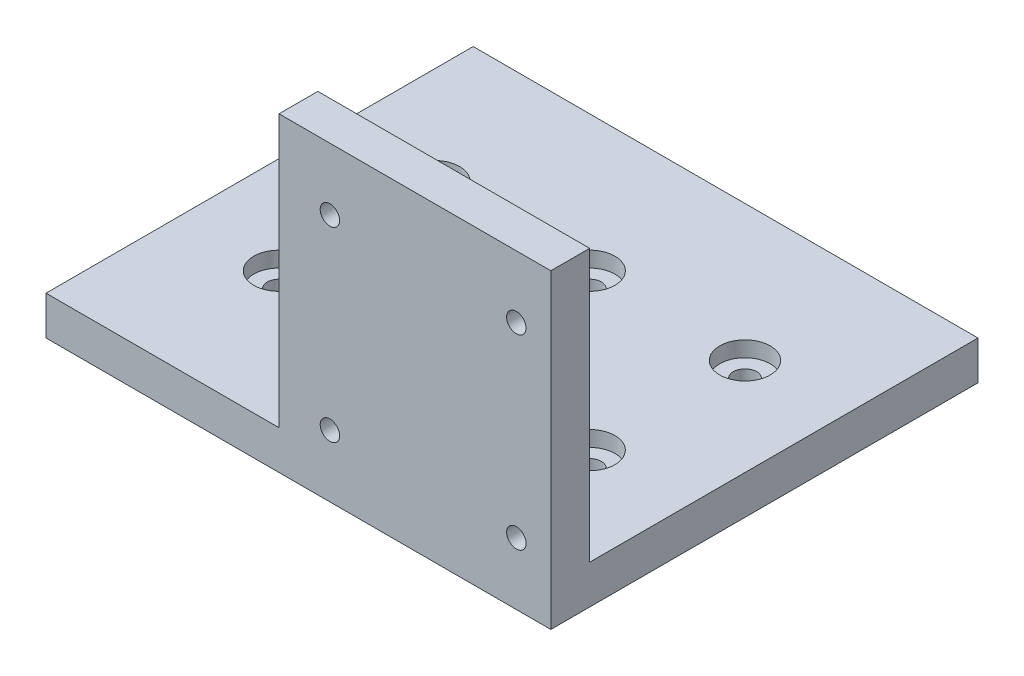
from build123d import *

# Parameters (mm, degrees)
SKETCH1_W            = 65
SKETCH1_H            = 55
BOSS_EXTRUDE1_DEPTH  = 5
SKETCH2_R            = 1.5
CUT_EXTRUDE1_DEPTH   = 5
SKETCH3_R            = 3.25
CUT_EXTRUDE2_DEPTH   = 2
LPATTERN1_COUNT      = 2
LPATTERN1_PITCH      = 20
LPATTERN1_COUNT_DIR2 = 3
LPATTERN1_PITCH_DIR2 = 20
SKETCH5_W            = 35
SKETCH5_H            = 5
BOSS_EXTRUDE2_DEPTH  = 35
SKETCH6_R            = 1.25
CUT_EXTRUDE3_DEPTH   = 35


with BuildPart() as part:
    # Sketch1 → Boss-Extrude1 (new body)
    with BuildSketch(Plane(origin=(0, 0, 0), x_dir=(1, 0, 0), z_dir=(0, 1, 0))):
        Rectangle(SKETCH1_W, SKETCH1_H)
    extrude(amount=BOSS_EXTRUDE1_DEPTH)

    # Sketch2 → Cut-Extrude1 (cut)
    with BuildSketch(Plane(origin=(0, 5, 0), x_dir=(1, 0, 0), z_dir=(0, 1, 0))):
        with Locations(Location((-20, 10, 0), (0, 0, 270))):
            Circle(SKETCH2_R)
        with Locations(Location((0, 10, 0), (0, 0, 270))):
            Circle(SKETCH2_R)
        with Locations(Location((20, 10, 0), (0, 0, 270))):
            Circle(SKETCH2_R)
        with Locations(Location((-20, -10, 0), (0, 0, 270))):
            Circle(SKETCH2_R)
        with Locations(Location((0, -10, 0), (0, 0, 270))):
            Circle(SKETCH2_R)
        with Locations(Location((20, -10, 0), (0, 0, 270))):
            Circle(SKETCH2_R)
    extrude(amount=-CUT_EXTRUDE1_DEPTH, mode=Mode.SUBTRACT)

    # Sketch3 → Cut-Extrude2 (cut)
    with BuildSketch(Plane(origin=(0, 5, 0), x_dir=(1, 0, 0), z_dir=(0, 1, 0))):
        with Locations(Location((-20, 10, 0), (0, 0, 270))):
            Circle(SKETCH3_R)
    cut_extrude2 = extrude(amount=-CUT_EXTRUDE2_DEPTH, mode=Mode.SUBTRACT)

    # LPattern1: Cut-Extrude2 2 × 3
    with Locations(*[(j * LPATTERN1_PITCH_DIR2, 0, i * LPATTERN1_PITCH) for i in range(LPATTERN1_COUNT) for j in range(LPATTERN1_COUNT_DIR2) if (i, j) != (0, 0)]):
        add(cut_extrude2, mode=Mode.SUBTRACT)

    # Sketch5 → Boss-Extrude2 (add)
    with BuildSketch(Plane(origin=(0, 5, 0), x_dir=(1, 0, 0), z_dir=(0, 1, 0))):
        with Locations((15, -25)):
            Rectangle(SKETCH5_W, SKETCH5_H)
    extrude(amount=BOSS_EXTRUDE2_DEPTH)

    # Sketch6 → Cut-Extrude3 (cut)
    with BuildSketch(Plane.XY.offset(27.5)):
        with Locations((4.055342901, 32)):
            Circle(SKETCH6_R)
        with Locations((4.055342901, 8)):
            Circle(SKETCH6_R)
        with Locations((28.055342901, 32)):
            Circle(SKETCH6_R)
        with Locations((28.055342901, 8)):
            Circle(SKETCH6_R)
    extrude(amount=-CUT_EXTRUDE3_DEPTH, mode=Mode.SUBTRACT)


solid = part.part
